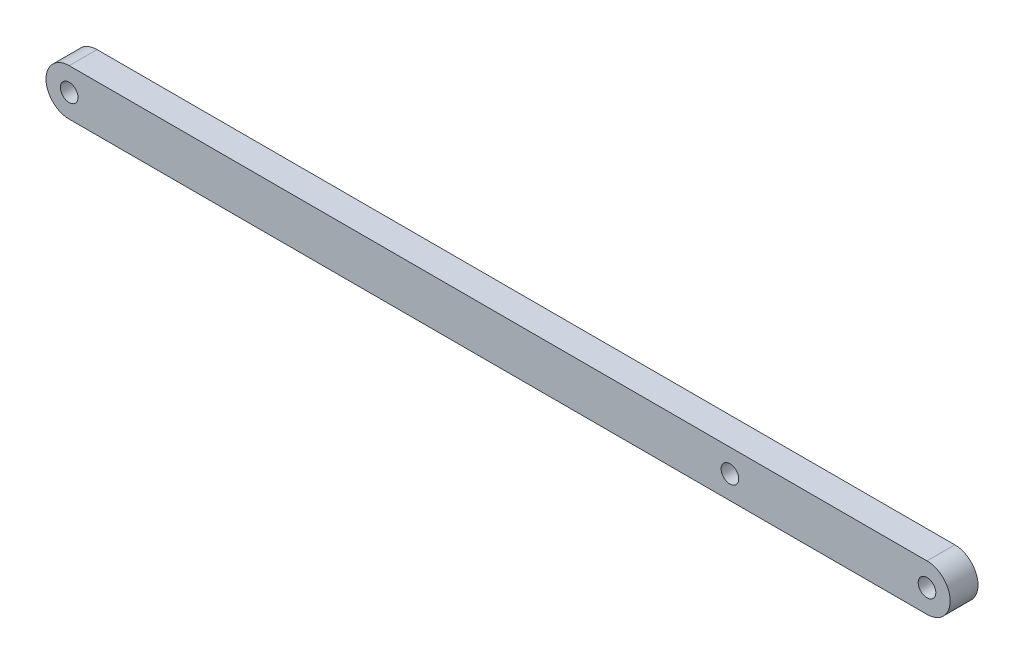
from build123d import *

# Parameters (mm, degrees)
SKETCH1_R           = 1.9
BOSS_EXTRUDE1_DEPTH = 6


with BuildPart() as part:
    # Sketch1 → Boss-Extrude1 (new body)
    with BuildSketch(Plane.XY):
        with BuildLine():
            Line((-92.5, 5), (92.5, 5))
            ThreePointArc((92.5, 5), (97.5, 0), (92.5, -5))
            Line((92.5, -5), (-92.5, -5))
            ThreePointArc((-92.5, -5), (-97.5, 0), (-92.5, 5))
        make_face()
        with Locations((-92.5, 0)):
            Circle(SKETCH1_R, mode=Mode.SUBTRACT)
        with Locations((92.5, 0)):
            Circle(SKETCH1_R, mode=Mode.SUBTRACT)
        with Locations((50, 0)):
            Circle(SKETCH1_R, mode=Mode.SUBTRACT)
    extrude(amount=BOSS_EXTRUDE1_DEPTH)


solid = part.part
